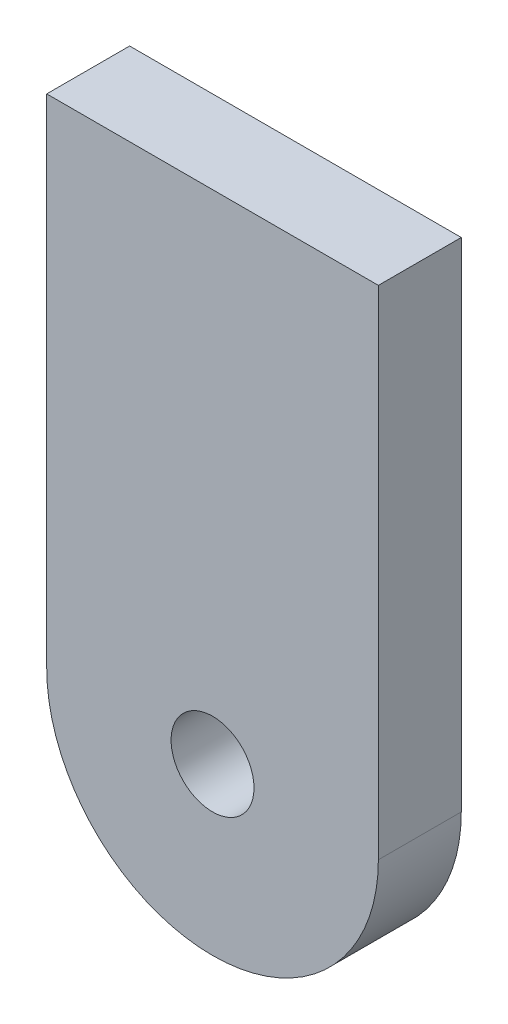
from build123d import *

# Parameters (mm, degrees)
SKETCH1_R           = 2.5
BOSS_EXTRUDE1_DEPTH = 2.5


with BuildPart() as part:
    # Sketch1 → Boss-Extrude1 (new, symmetric)
    with BuildSketch(Plane.XY):
        with BuildLine():
            Line((10, 0), (10, 30))
            Line((10, 30), (-10, 30))
            Line((-10, 30), (-10, 0))
            ThreePointArc((-10, 0), (0, -10), (10, 0))
        make_face()
        Circle(SKETCH1_R, mode=Mode.SUBTRACT)
    extrude(amount=BOSS_EXTRUDE1_DEPTH, both=True)


solid = part.part
